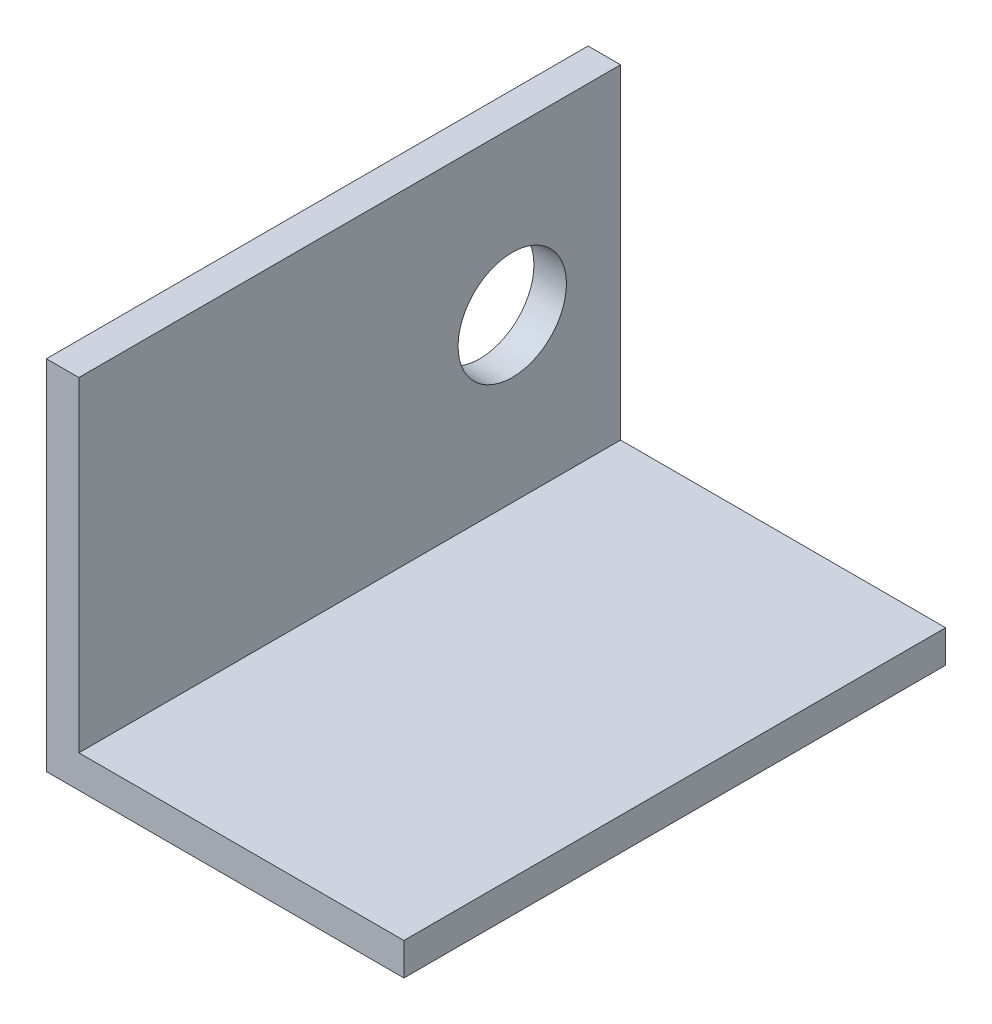
from build123d import *

# Parameters (mm, degrees)
EXTRUDE_1_DEPTH     = 50
SKETCH_2_R          = 5
CUT_EXTRUDE_1_DEPTH = 10


with BuildPart() as part:
    # Эскиз1 → Вытянуть-Тонкостенный1 (new body)
    with BuildSketch(Plane.XY):
        Polygon((0, 30), (0, 0), (30, 0), (30, -3), (-3, -3), (-3, 30), align=None)
    extrude(amount=-EXTRUDE_1_DEPTH)

    # Эскиз2 → Вырез-Вытянуть1 (cut)
    with BuildSketch(Plane.ZY.offset(3)):
        with Locations(Location((-40, 15, 0), (0, 0, 270))):
            Circle(SKETCH_2_R)
    extrude(amount=-CUT_EXTRUDE_1_DEPTH, mode=Mode.SUBTRACT)


solid = part.part
